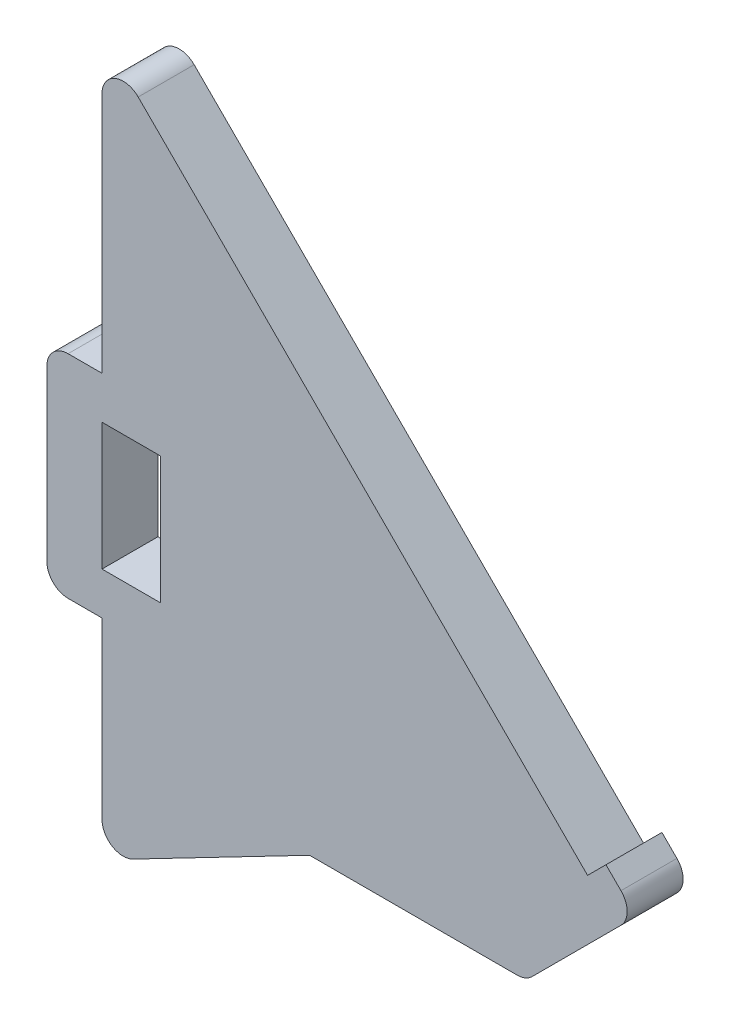
from build123d import *

# Parameters (mm, degrees)
MODEL_W             = 6.88
MODEL_H             = 15
BOSS_EXTRUDE1_DEPTH = 6.6


with BuildPart() as part:
    # Model → Boss-Extrude1 (new body)
    with BuildSketch(Plane.XY):
        with BuildLine():
            Line((0, -59.622366364), (-4, -59.622366364))
            ThreePointArc((-4, -59.622366364), (-5.767766953, -58.890133317), (-6.5, -57.122366364))
            Line((-6.5, -57.122366364), (-6.5, -37.122366364))
            ThreePointArc((-6.5, -37.122366364), (-5.767766953, -35.354599411), (-4, -34.622366364))
            Line((-4, -34.622366364), (0, -34.622366364))
            Line((0, -34.622366364), (0, -6.035533906))
            ThreePointArc((0, -6.035533906), (1.543291419, -3.725835075), (4.267766953, -4.267766953))
            Line((4.267766953, -4.267766953), (57.275649276, -57.275649276))
            Line((57.275649276, -57.275649276), (59.446467094, -55.104831458))
            Line((59.446467094, -55.104831458), (61.214234047, -56.872598411))
            ThreePointArc((61.214234047, -56.872598411), (61.946467094, -58.640365364), (61.214234047, -60.408132317))
            Line((61.214234047, -60.408132317), (50.732233047, -70.890133317))
            ThreePointArc((50.732233047, -70.890133317), (49.921174675, -71.432065195), (48.964466094, -71.622366364))
            Line((48.964466094, -71.622366364), (24.482233047, -71.622366364))
            Line((24.482233047, -71.622366364), (3.651186429, -82.428337026))
            ThreePointArc((3.651186429, -82.428337026), (1.201532841, -82.345502849), (0, -80.209154788))
            Line((0, -80.209154788), (0, -59.622366364))
        make_face()
        with Locations((3.44, -47.122366364)):
            Rectangle(MODEL_W, MODEL_H, mode=Mode.SUBTRACT)
    extrude(amount=BOSS_EXTRUDE1_DEPTH)


solid = part.part
